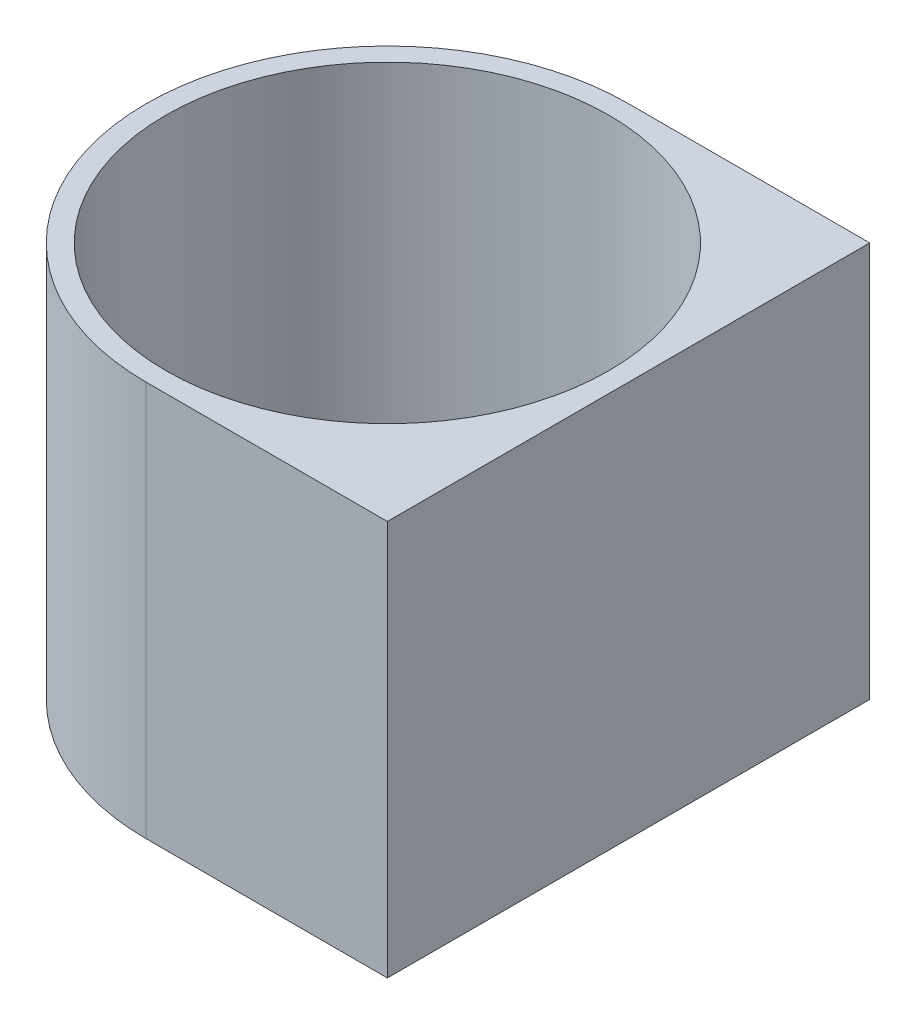
from build123d import *

# Parameters (mm, degrees)
SKETCH1_R                = 38.735
SKETCH1_R_2              = 35.56
BOSS_EXTRUDE1_DEPTH      = 63.5
BOSS_EXTRUDE2_REACH      = 109.398
BOSS_EXTRUDE2_END_RADIUS = 38.735
SKETCH2_W                = 77.47
SKETCH2_H                = 63.5


with BuildPart() as part:
    # Sketch1 → Boss-Extrude1 (new body)
    with BuildSketch(Plane(origin=(0, 0, 0), x_dir=(1, 0, 0), z_dir=(0, 1, 0))):
        with Locations(Location((0, 0, 0), (0, 0, 270))):
            Circle(SKETCH1_R)
        with Locations(Location((0, 0, 0), (0, 0, 270))):
            Circle(SKETCH1_R_2, mode=Mode.SUBTRACT)
    extrude(amount=BOSS_EXTRUDE1_DEPTH)

    # Boss-Extrude2: up to this cylinder (the profile starts outside it)
    boss_extrude2_end = Plane(origin=(0, 31.75, 0), z_dir=(0, -1, 0)) * Cylinder(BOSS_EXTRUDE2_END_RADIUS, 297.266, mode=Mode.PRIVATE)
    # Sketch2 → Boss-Extrude2 (add, up to the surface)
    with BuildSketch(Plane(origin=(38.735, 0, 0), x_dir=(0, 0, -1), z_dir=(1, 0, 0)), mode=Mode.PRIVATE) as boss_extrude2_sk1:
        with Locations((0, 31.75)):
            Rectangle(SKETCH2_W, SKETCH2_H)
    boss_extrude2_tool1 = extrude(boss_extrude2_sk1.sketch, amount=-BOSS_EXTRUDE2_REACH, mode=Mode.PRIVATE) - boss_extrude2_end
    add(boss_extrude2_tool1.solids().sort_by_distance((38.735, 31.75, 0))[0])
    add(boss_extrude2_tool1.solids().sort_by_distance((38.735, 31.75, 0))[1])


solid = part.part
